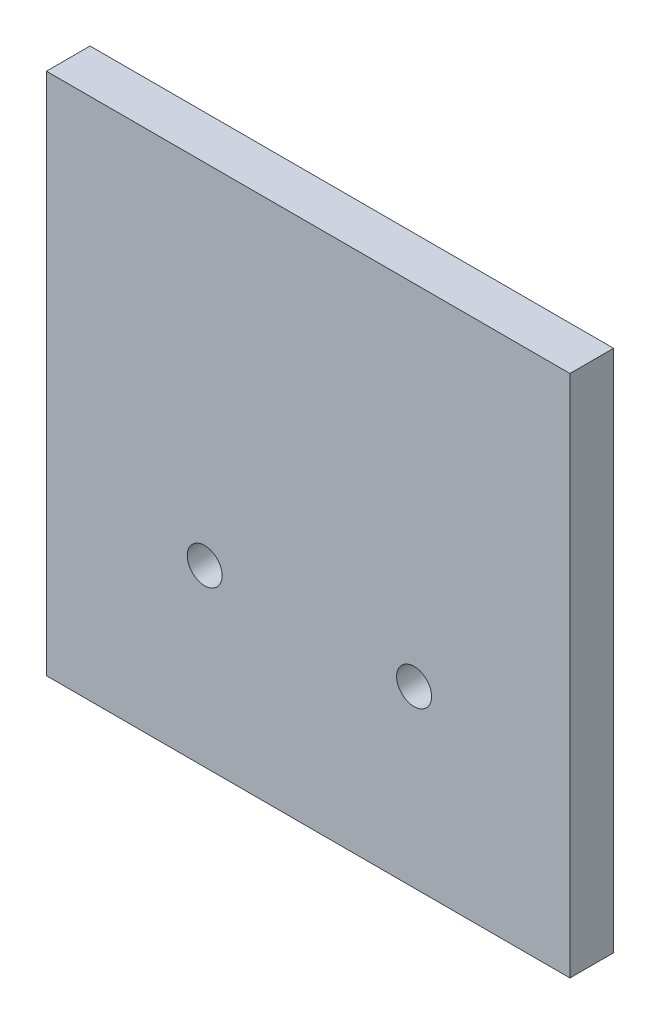
from build123d import *

# Parameters (mm, degrees)
CROQUIS1_W              = 300
CROQUIS1_H              = 300
SALIENTE_EXTRUIR1_DEPTH = 25
CROQUIS2_R              = 10
CORTAR_EXTRUIR1_DEPTH   = 25


with BuildPart() as part:
    # Croquis1 → Saliente-Extruir1 (new body)
    with BuildSketch(Plane.XY):
        with Locations((-0.688455906, -45.089285714)):
            Rectangle(CROQUIS1_W, CROQUIS1_H)
    extrude(amount=SALIENTE_EXTRUIR1_DEPTH)

    # Croquis2 → Cortar-Extruir1 (cut)
    with BuildSketch(Plane.XY.offset(25)):
        with Locations((-60, -95.089285714)):
            Circle(CROQUIS2_R)
        with Locations((60, -95.089285714)):
            Circle(CROQUIS2_R)
    extrude(amount=-CORTAR_EXTRUIR1_DEPTH, mode=Mode.SUBTRACT)


solid = part.part
